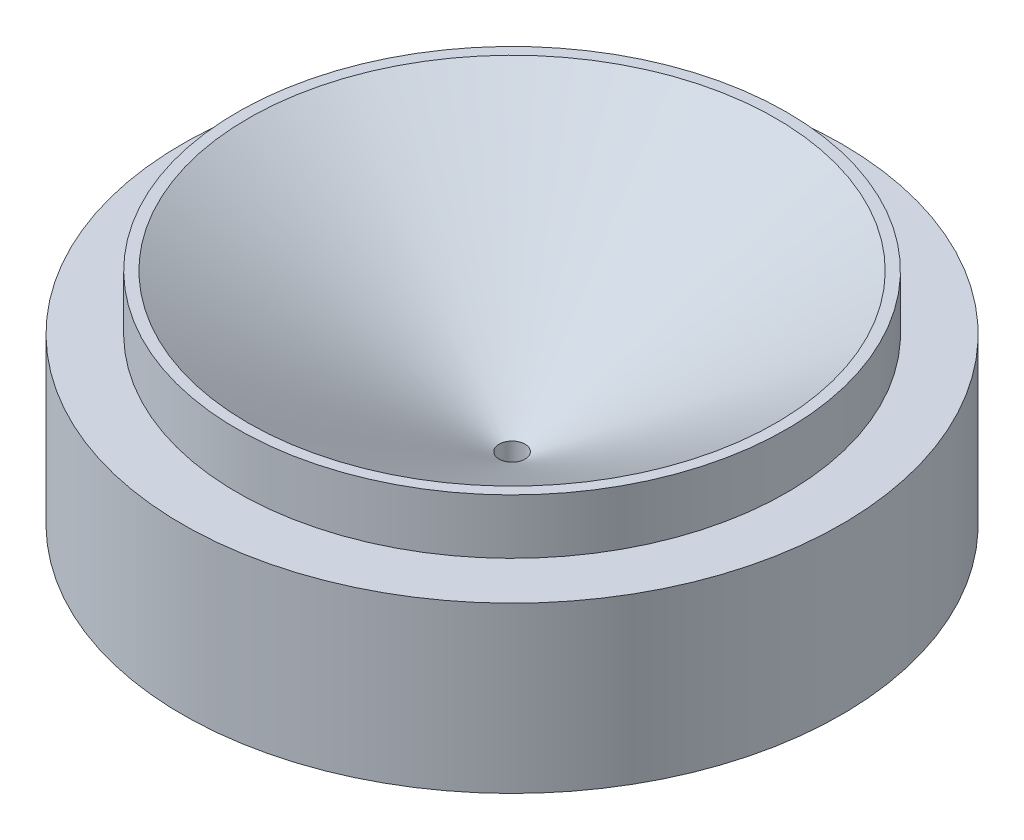
from build123d import *

# Parameters (mm, degrees)
SKETCH2_R          = 1.5
CUT_EXTRUDE1_DEPTH = 60.56828015


with BuildPart() as part:
    # Sketch1 → Revolve1 (revolve)
    with BuildSketch(Plane.XY, mode=Mode.PRIVATE) as revolve1_sk:
        Polygon((0, -12.7), (30.5054, 6.35), (31.75, 6.35), (31.75, 0), (38.1, 0), (38.1, -19.05), (0, -19.05), align=None)
    revolve(revolve1_sk.sketch.rotate(Axis((0, -19.05, 0), (0, 1, 0)), 90), axis=Axis((0, -19.05, 0), (0, 1, 0)))

    # Sketch2 → Cut-Extrude1 (cut, through all)
    with BuildSketch(Plane.XZ.offset(19.05)):
        with Locations(Location((0, 0, 0), (0, 0, 270))):
            Circle(SKETCH2_R)
    extrude(amount=-CUT_EXTRUDE1_DEPTH, mode=Mode.SUBTRACT)


solid = part.part
